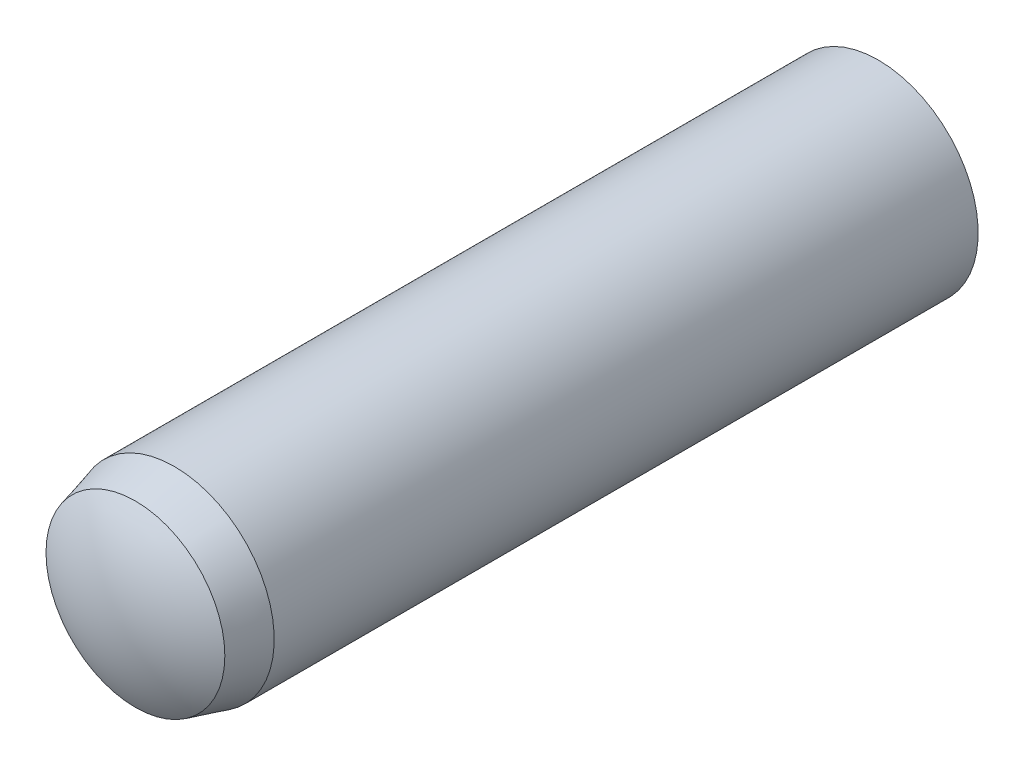
from build123d import *


with BuildPart() as part:
    # Sketch3 → Revolve1 (revolve)
    with BuildSketch(Plane(origin=(0, 0, 0), x_dir=(0, 0, -1), z_dir=(1, 0, 0)), mode=Mode.PRIVATE) as revolve1_sk:
        with BuildLine():
            Line((-20, 0), (20, 0))
            ThreePointArc((20, 0), (19.616922091, 2.610076627), (18.5, 5))
            Line((18.5, 5), (-16.75, 5))
            Line((-16.75, 5), (-18.7, 4.477499075))
            ThreePointArc((-18.7, 4.477499075), (-19.668425132, 2.331201298), (-20, 0))
        make_face()
    revolve(revolve1_sk.sketch.rotate(Axis((0, 0, 20), (0, 0, -1)), 180), axis=Axis((0, 0, 20), (0, 0, -1)))


solid = part.part
